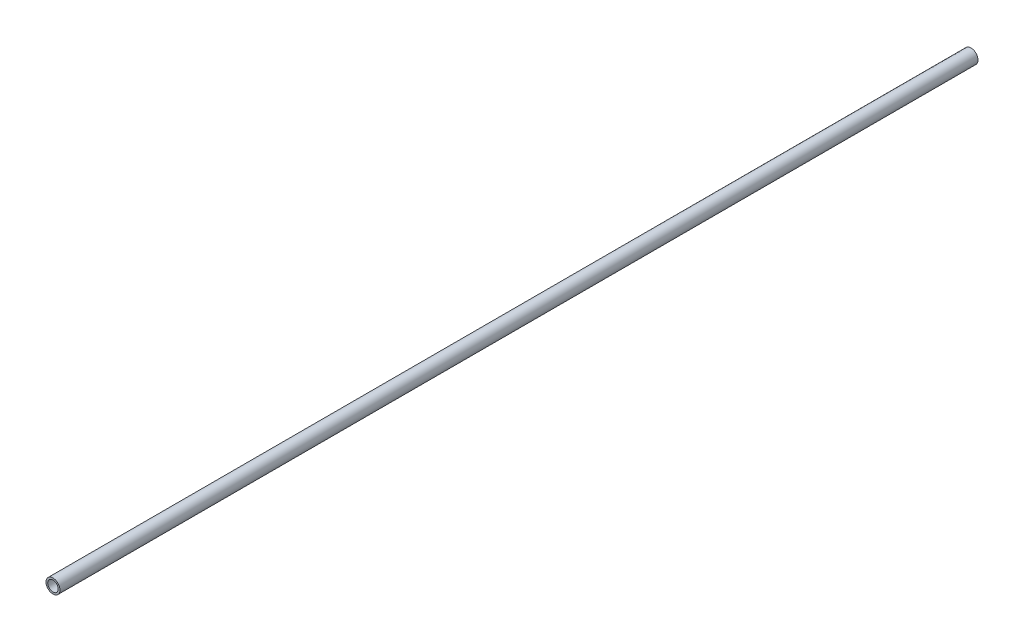
from build123d import *

# Parameters (mm, degrees)
SKETCH1_R           = 3.175
SKETCH1_R_2         = 2.38125
BOSS_EXTRUDE1_DEPTH = 208.8


with BuildPart() as part:
    # Sketch1 → Boss-Extrude1 (new, symmetric)
    with BuildSketch(Plane.XY):
        Circle(SKETCH1_R)
        Circle(SKETCH1_R_2, mode=Mode.SUBTRACT)
    extrude(amount=BOSS_EXTRUDE1_DEPTH, both=True)


solid = part.part
